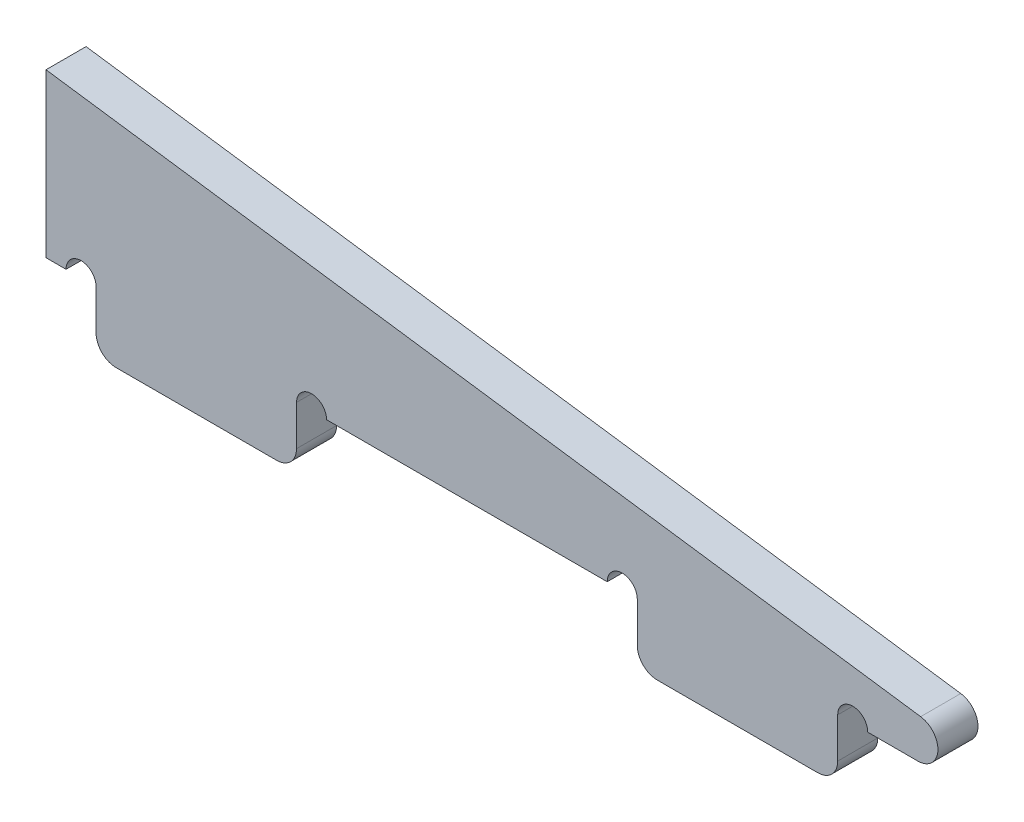
from build123d import *

# Parameters (mm, degrees)
EXTRUDE_1_DEPTH     = 2
SKETCH_2_R          = 0.75
CUT_EXTRUDE_1_DEPTH = 41.376216741
FILLET_1_R          = 1


with BuildPart() as part:
    # 草图1 → 凸台-拉伸1 (new body)
    with BuildSketch(Plane.XY):
        with BuildLine():
            Line((4.139173101, 1.990268069), (-39.5, 8.123353882))
            Line((-39.5, 8.123353882), (-39.5, 0))
            Line((-39.5, 0), (-37, 0))
            Line((-37, 0), (-37, -3))
            Line((-37, -3), (-27, -3))
            Line((-27, -3), (-27, 0))
            Line((-27, 0), (-10, 0))
            Line((-10, 0), (-10, -3))
            Line((-10, -3), (0, -3))
            Line((0, -3), (0, 0))
            Line((0, 0), (4, 0))
            ThreePointArc((4, 0), (4.99756405, 0.930243526), (4.139173101, 1.990268069))
        make_face()
    extrude(amount=EXTRUDE_1_DEPTH)

    # 草图2 → 切除-拉伸1 (cut, through all)
    with BuildSketch(Plane.XY.offset(2)):
        with Locations((-37.75, 0)):
            Circle(SKETCH_2_R)
        with Locations((-26.25, 0)):
            Circle(SKETCH_2_R)
        with Locations((-10.75, 0)):
            Circle(SKETCH_2_R)
        with Locations((0.75, 0)):
            Circle(SKETCH_2_R)
    extrude(amount=-CUT_EXTRUDE_1_DEPTH, mode=Mode.SUBTRACT)

    # 圆角1
    fillet_1_edges = [part.edges().sort_by_distance(p)[0] for p in [
        (0, -3, 1),
        (-10, -3, 1),
        (-27, -3, 1),
        (-37, -3, 1),
    ]]
    fillet(fillet_1_edges, radius=FILLET_1_R)


solid = part.part
